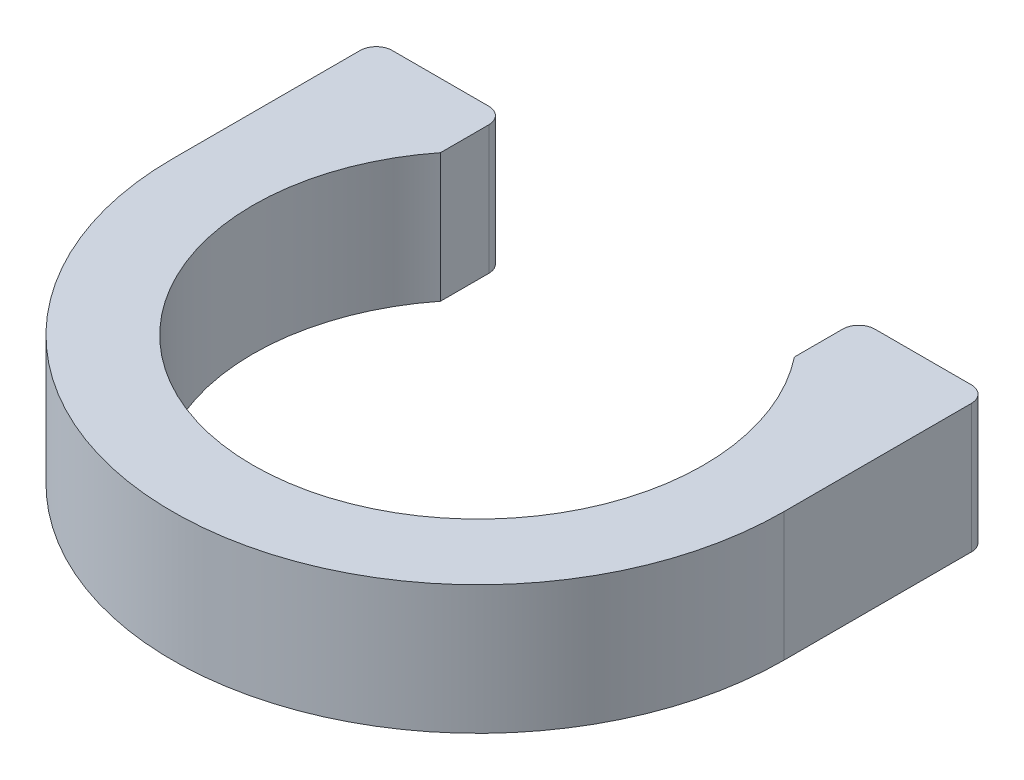
from build123d import *

# Parameters (mm, degrees)
BOSS_EXTRUDE1_DEPTH = 4


with BuildPart() as part:
    # Sketch1 → Boss-Extrude1 (new body)
    with BuildSketch(Plane(origin=(0, 0, 0), x_dir=(1, 0, 0), z_dir=(0, 1, 0))):
        with BuildLine():
            ThreePointArc((-5.5, 7.415063509), (-5.646446609, 7.7686169), (-6, 7.915063509))
            Line((-6, 7.915063509), (-9, 7.915063509))
            ThreePointArc((-9, 7.915063509), (-9.353553391, 7.7686169), (-9.5, 7.415063509))
            Line((-9.5, 7.415063509), (-9.5, 1.584936491))
            ThreePointArc((-9.5, 1.584936491), (0, -7.915063509), (9.5, 1.584936491))
            Line((9.5, 1.584936491), (9.5, 7.415063509))
            ThreePointArc((9.5, 7.415063509), (9.353553391, 7.7686169), (9, 7.915063509))
            Line((9, 7.915063509), (6, 7.915063509))
            ThreePointArc((6, 7.915063509), (5.646446609, 7.7686169), (5.5, 7.415063509))
            Line((5.5, 7.415063509), (5.5, 5.915063509))
            ThreePointArc((5.5, 5.915063509), (6.614378278, 3.876224338), (7, 1.584936491))
            ThreePointArc((7, 1.584936491), (0, -5.415063509), (-7, 1.584936491))
            ThreePointArc((-7, 1.584936491), (-6.614378278, 3.876224338), (-5.5, 5.915063509))
            Line((-5.5, 5.915063509), (-5.5, 7.415063509))
        make_face()
    extrude(amount=BOSS_EXTRUDE1_DEPTH)


solid = part.part
